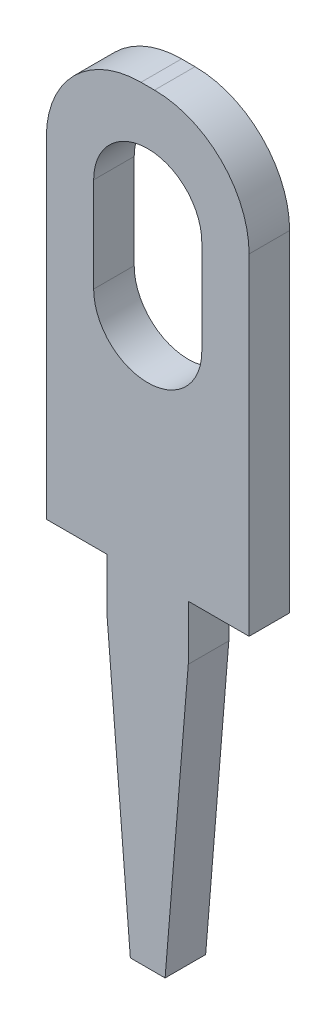
from build123d import *

# Parameters (mm, degrees)
ESTRUSIONE_ESTRUSIONE1_DEPTH = 0.6


with BuildPart() as part:
    # Schizzo1 → Estrusione-Estrusione1 (new body)
    with BuildSketch(Plane.XY):
        with BuildLine():
            Line((-1.5, 0), (-0.6, 0))
            Line((-0.6, 0), (-0.6, -0.808174013))
            Line((-0.6, -0.808174013), (-0.257137319, -5))
            Line((-0.257137319, -5), (0.257137319, -5))
            Line((0.257137319, -5), (0.6, -0.808174013))
            Line((0.6, -0.808174013), (0.6, 0))
            Line((0.6, 0), (1.5, 0))
            Line((1.5, 0), (1.5, 4.9))
            ThreePointArc((1.5, 4.9), (1.089949494, 5.889949494), (0.1, 6.3))
            Line((0.1, 6.3), (-0.1, 6.3))
            ThreePointArc((-0.1, 6.3), (-1.089949494, 5.889949494), (-1.5, 4.9))
            Line((-1.5, 4.9), (-1.5, 0))
        make_face()
        with BuildLine():
            Line((0.8, 4.7), (0.8, 3.3))
            ThreePointArc((0.8, 3.3), (0, 2.5), (-0.8, 3.3))
            Line((-0.8, 3.3), (-0.8, 4.7))
            ThreePointArc((-0.8, 4.7), (0, 5.5), (0.8, 4.7))
        make_face(mode=Mode.SUBTRACT)
    extrude(amount=ESTRUSIONE_ESTRUSIONE1_DEPTH)


solid = part.part
